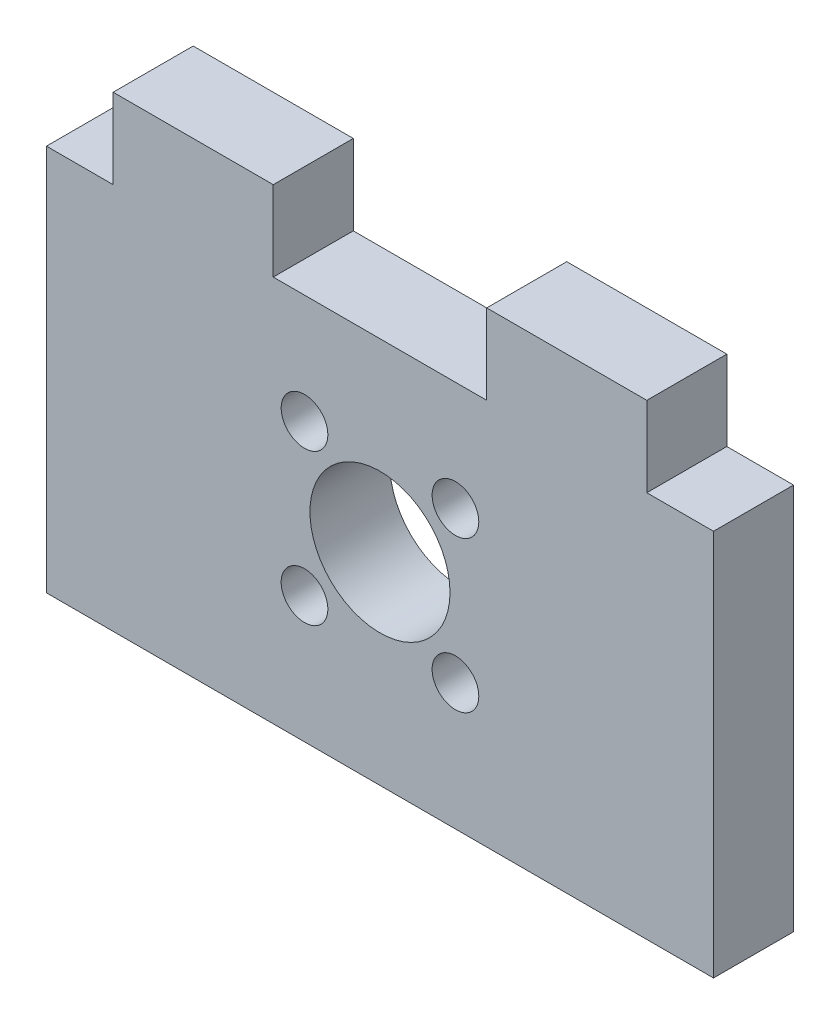
from build123d import *

# Parameters (mm, degrees)
ESBO_O1_W                = 50
ESBO_O1_H                = 35
ESBO_O1_R                = 5.25
ESBO_O1_R_2              = 1.75
RESSALTO_EXTRUS_O1_DEPTH = 6
ESBO_O2_W                = 16
ESBO_O2_H                = 6
ESBO_O2_W_2              = 5
CORTE_EXTRUS_O1_DEPTH    = 6


with BuildPart() as part:
    # Esboço1 → Ressalto-extrusão1 (new body)
    with BuildSketch(Plane.XY):
        Rectangle(ESBO_O1_W, ESBO_O1_H)
        with Locations((0, -2.35)):
            Circle(ESBO_O1_R, mode=Mode.SUBTRACT)
        with Locations((5.656854249, 3.306854249)):
            Circle(ESBO_O1_R_2, mode=Mode.SUBTRACT)
        with Locations((-5.656854249, 3.306854249)):
            Circle(ESBO_O1_R_2, mode=Mode.SUBTRACT)
        with Locations((-5.656854249, -8.006854249)):
            Circle(ESBO_O1_R_2, mode=Mode.SUBTRACT)
        with Locations((5.656854249, -8.006854249)):
            Circle(ESBO_O1_R_2, mode=Mode.SUBTRACT)
    extrude(amount=RESSALTO_EXTRUS_O1_DEPTH)

    # Esboço2 → Corte-extrusão1 (cut)
    with BuildSketch(Plane.XY.offset(6)):
        with Locations((0, 14.5)):
            Rectangle(ESBO_O2_W, ESBO_O2_H)
        with Locations((-22.5, 14.5)):
            Rectangle(ESBO_O2_W_2, ESBO_O2_H)
        with Locations((22.5, 14.5)):
            Rectangle(ESBO_O2_W_2, ESBO_O2_H)
    extrude(amount=-CORTE_EXTRUS_O1_DEPTH, mode=Mode.SUBTRACT)


solid = part.part
